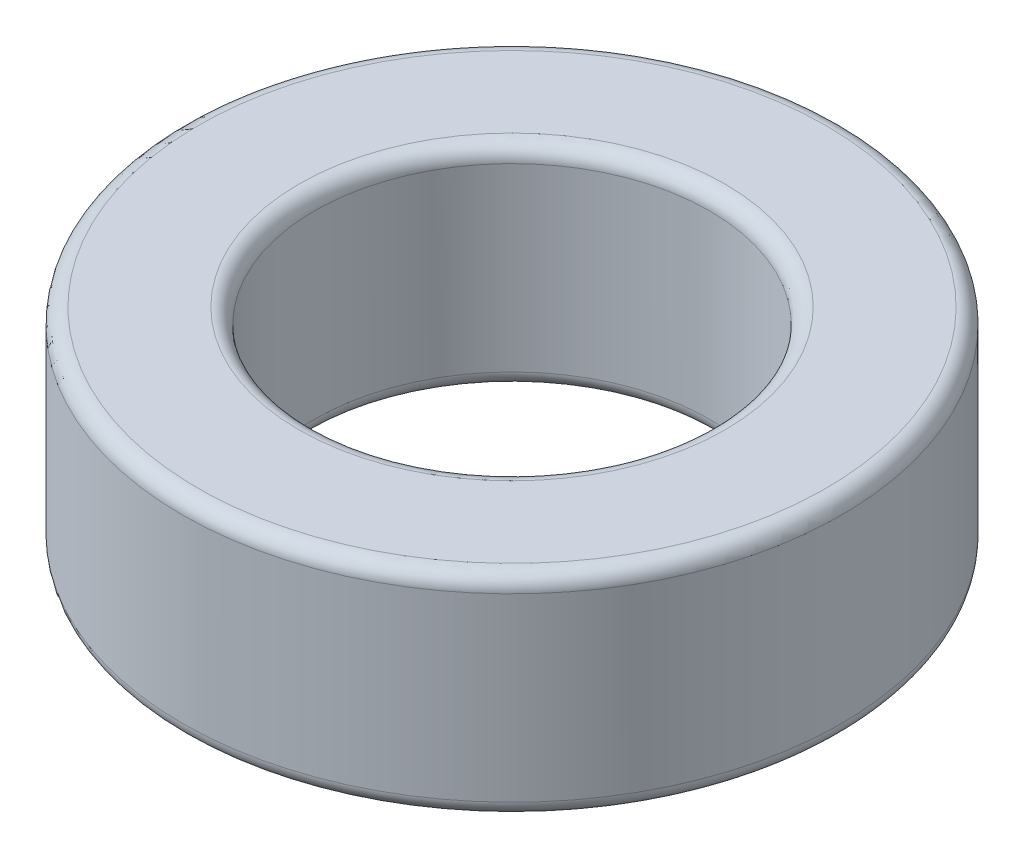
from build123d import *

# Parameters (mm, degrees)
SKETCH1_W = 8.525
SKETCH1_H = 13.65
FILLET1_R = 1


with BuildPart() as part:
    # Sketch1 → Revolve1 (revolve)
    with BuildSketch(Plane.XY, mode=Mode.PRIVATE) as revolve1_sk:
        with Locations((17.0125, 0)):
            Rectangle(SKETCH1_W, SKETCH1_H)
    revolve(revolve1_sk.sketch.rotate(Axis((0, 15.88658147, 0), (0, -1, 0)), 90), axis=Axis((0, 15.88658147, 0), (0, -1, 0)))

    # Fillet1
    fillet1_edges = [part.edges().sort_by_distance(p)[0] for p in [
        (0, -6.825, -21.275),
        (0, -6.825, -12.75),
        (0, 6.825, -12.75),
        (0, 6.825, -21.275),
    ]]
    fillet(fillet1_edges, radius=FILLET1_R)


solid = part.part
